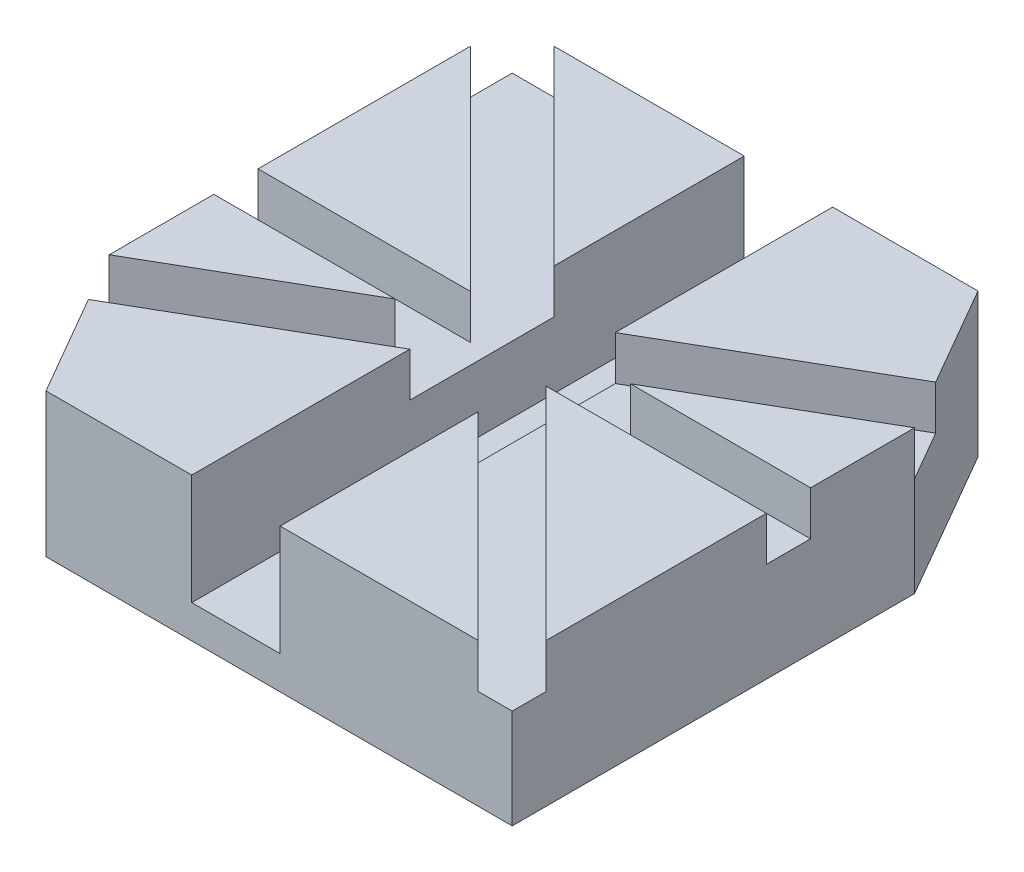
from build123d import *

# Parameters (mm, degrees)
SKETCH_2_W          = 50
SKETCH_2_H          = 50
EXTRUDE_1_DEPTH     = 13
SKETCH_3_W          = 8
SKETCH_3_H          = 50
CUT_EXTRUDE_1_DEPTH = 10
SKETCH_4_W          = 50
SKETCH_4_H          = 4
CUT_EXTRUDE_2_DEPTH = 4
CUT_EXTRUDE_4_DEPTH = 4
CUT_EXTRUDE_5_DEPTH = 4
CUT_EXTRUDE_6_DEPTH = 4
CUT_EXTRUDE_7_DEPTH = 4
CUT_EXTRUDE_8_DEPTH = 38.669616404


with BuildPart() as part:
    # 草图2 → 凸台-拉伸1 (new body)
    with BuildSketch(Plane(origin=(0, 0, 0), x_dir=(1, 0, 0), z_dir=(0, 1, 0))):
        Rectangle(SKETCH_2_W, SKETCH_2_H)
    extrude(amount=EXTRUDE_1_DEPTH)

    # 草图3 → 切除-拉伸1 (cut)
    with BuildSketch(Plane(origin=(0, 13, 0), x_dir=(1, 0, 0), z_dir=(0, 1, 0))):
        Rectangle(SKETCH_3_W, SKETCH_3_H)
    extrude(amount=-CUT_EXTRUDE_1_DEPTH, mode=Mode.SUBTRACT)

    # 草图4 → 切除-拉伸2 (cut)
    with BuildSketch(Plane(origin=(0, 13, 0), x_dir=(1, 0, 0), z_dir=(0, 1, 0))):
        Rectangle(SKETCH_4_W, SKETCH_4_H)
    extrude(amount=-CUT_EXTRUDE_2_DEPTH, mode=Mode.SUBTRACT)

    # 草图5 → 切除-拉伸4 (cut)
    with BuildSketch(Plane(origin=(0, 13, 0), x_dir=(1, 0, 0), z_dir=(0, 1, 0))):
        Polygon((-1.282274203, 2.220964068), (1.282274203, -2.220964068), (-26.199867727, -18.087786109), (-28.764416132, -13.645857973), align=None)
    extrude(amount=-CUT_EXTRUDE_4_DEPTH, mode=Mode.SUBTRACT)

    # 草图7 → 切除-拉伸5 (cut)
    with BuildSketch(Plane(origin=(0, 13, 0), x_dir=(1, 0, 0), z_dir=(0, 1, 0))):
        Polygon((-1.881421881, -1.881421881), (1.881421881, 1.881421881), (-24.724588242, 28.487432004), (-28.487432004, 24.724588242), align=None)
    extrude(amount=-CUT_EXTRUDE_5_DEPTH, mode=Mode.SUBTRACT)

    # 草图8 → 切除-拉伸6 (cut)
    with BuildSketch(Plane(origin=(0, 13, 0), x_dir=(1, 0, 0), z_dir=(0, 1, 0))):
        Polygon((-1.54081376, -1.54081376), (1.54081376, 1.54081376), (29.908508957, -26.826881437), (26.826881437, -29.908508957), align=None)
    extrude(amount=-CUT_EXTRUDE_6_DEPTH, mode=Mode.SUBTRACT)

    # 草图9 → 切除-拉伸7 (cut)
    with BuildSketch(Plane(origin=(0, 13, 0), x_dir=(1, 0, 0), z_dir=(0, 1, 0))):
        Polygon((-1.309113008, 2.267450243), (1.309113008, -2.267450243), (34.209084597, 16.72735721), (31.590858581, 21.262257696), align=None)
    extrude(amount=-CUT_EXTRUDE_7_DEPTH, mode=Mode.SUBTRACT)

    # 草图10 → 切除-拉伸8 (cut, through all)
    with BuildSketch(Plane(origin=(0, 13, 0), x_dir=(1, 0, 0), z_dir=(0, 1, 0))):
        Polygon((-25, -11.472471306), (-17.189877667, -25), (-25, -25), align=None)
        Polygon((25, 11.410489739), (17.154092593, 25), (25, 25), align=None)
    extrude(amount=-CUT_EXTRUDE_8_DEPTH, mode=Mode.SUBTRACT)


solid = part.part
